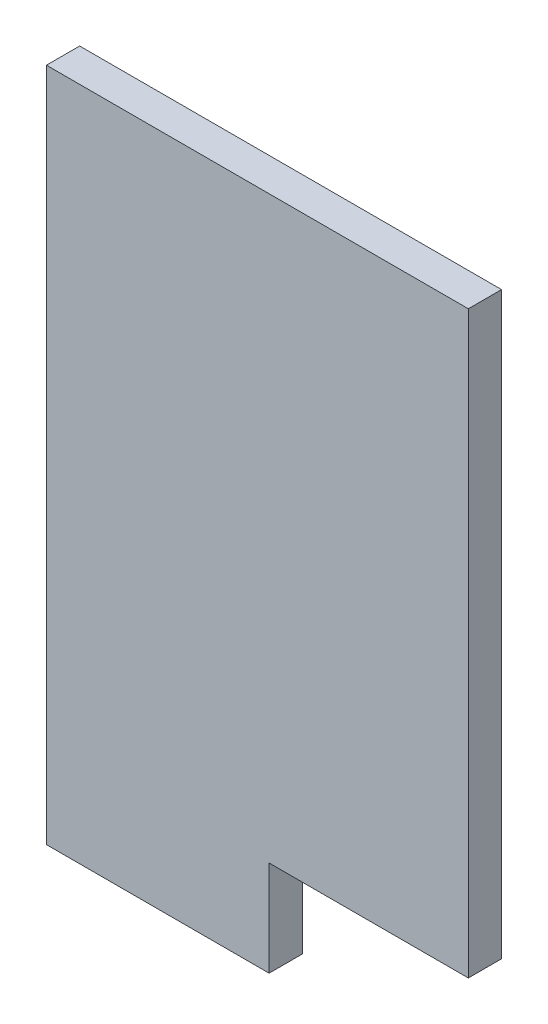
from build123d import *

# Parameters (mm, degrees)
BOSS_EXTRUDE1_DEPTH = 1.6002


with BuildPart() as part:
    # Sketch2 → Boss-Extrude1 (new body)
    with BuildSketch(Plane.XY):
        Polygon((-14.732, 9.1948), (-14.732, -23.3172), (-4.008, -23.3172), (-4.008, -18.7198), (5.588, -18.7198), (5.588, 9.1948), align=None)
    extrude(amount=BOSS_EXTRUDE1_DEPTH)


solid = part.part
